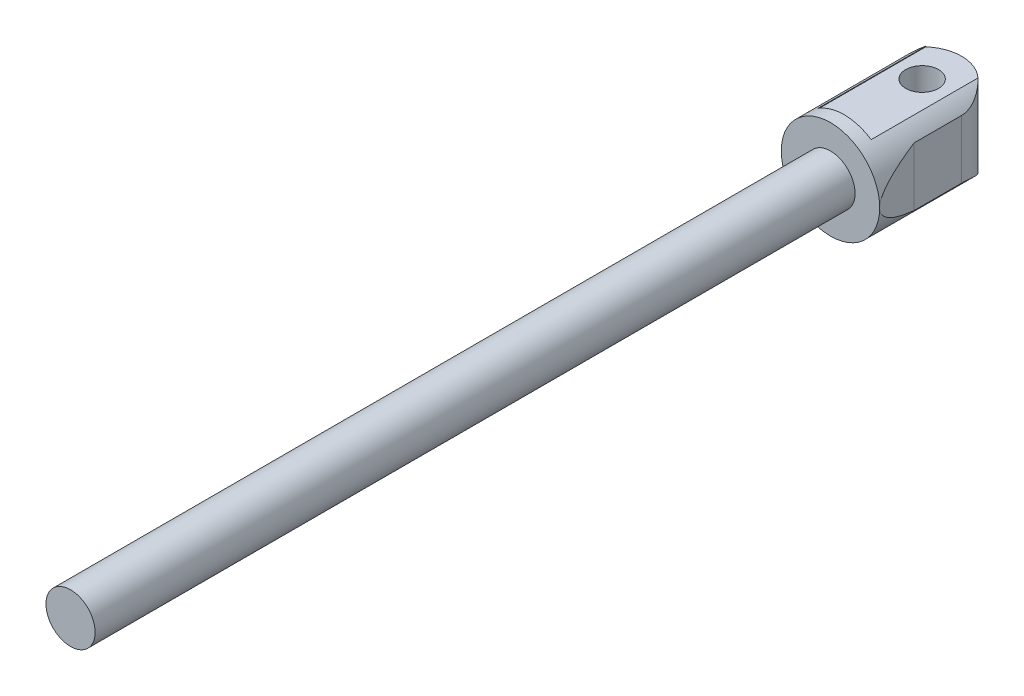
from build123d import *

# Parameters (mm, degrees)
SKETCH1_R           = 37.5
BOSS_EXTRUDE1_DEPTH = 579.5
SKETCH2_R           = 75
BOSS_EXTRUDE2_DEPTH = 200
SKETCH3_R           = 25
CUT_EXTRUDE1_DEPTH  = 100
SKETCH4_W           = 260.945871841
SKETCH4_H           = 75.746474917
CUT_EXTRUDE2_DEPTH  = 100


with BuildPart() as part:
    # Sketch1 → Boss-Extrude1 (new, symmetric)
    with BuildSketch(Plane.XY):
        Circle(SKETCH1_R)
    extrude(amount=BOSS_EXTRUDE1_DEPTH, both=True)

    # Sketch2 → Boss-Extrude2 (add)
    with BuildSketch(Plane(origin=(0, 0, -579.5), x_dir=(-1, 0, 0), z_dir=(0, 0, -1))):
        Circle(SKETCH2_R)
    extrude(amount=BOSS_EXTRUDE2_DEPTH)

    # Sketch3 → Cut-Extrude1 (cut, symmetric)
    with BuildSketch(Plane(origin=(0, 0, 0), x_dir=(1, 0, 0), z_dir=(0, 1, 0))):
        with Locations(Location((0, 719.26, 0), (0, 0, 270))):
            Circle(SKETCH3_R)
        with BuildLine():
            Line((60.24, 719.26), (60.24, 646.55))
            Line((60.24, 646.55), (75, 579.5))
            Line((75, 579.5), (150.12522471, 579.5))
            Line((150.12522471, 579.5), (155.105572786, 831.544185687))
            Line((155.105572786, 831.544185687), (-155.801518438, 837.687654259))
            Line((-155.801518438, 837.687654259), (-75, 579.5))
            Line((-75, 579.5), (-60.24, 646.55))
            Line((-60.24, 646.55), (-60.24, 719.26))
            ThreePointArc((-60.24, 719.26), (0, 779.5), (60.24, 719.26))
        make_face()
    extrude(amount=CUT_EXTRUDE1_DEPTH, both=True, mode=Mode.SUBTRACT)

    # Sketch4 → Cut-Extrude2 (cut, symmetric)
    with BuildSketch(Plane(origin=(60.24, 0, 0), x_dir=(0, 0, -1), z_dir=(1, 0, 0))):
        with Locations((730.83293592, 100.543237459)):
            Rectangle(SKETCH4_W, SKETCH4_H)
        with Locations((730.83293592, -100.543237459)):
            Rectangle(SKETCH4_W, SKETCH4_H)
    extrude(amount=CUT_EXTRUDE2_DEPTH, both=True, mode=Mode.SUBTRACT)


solid = part.part
